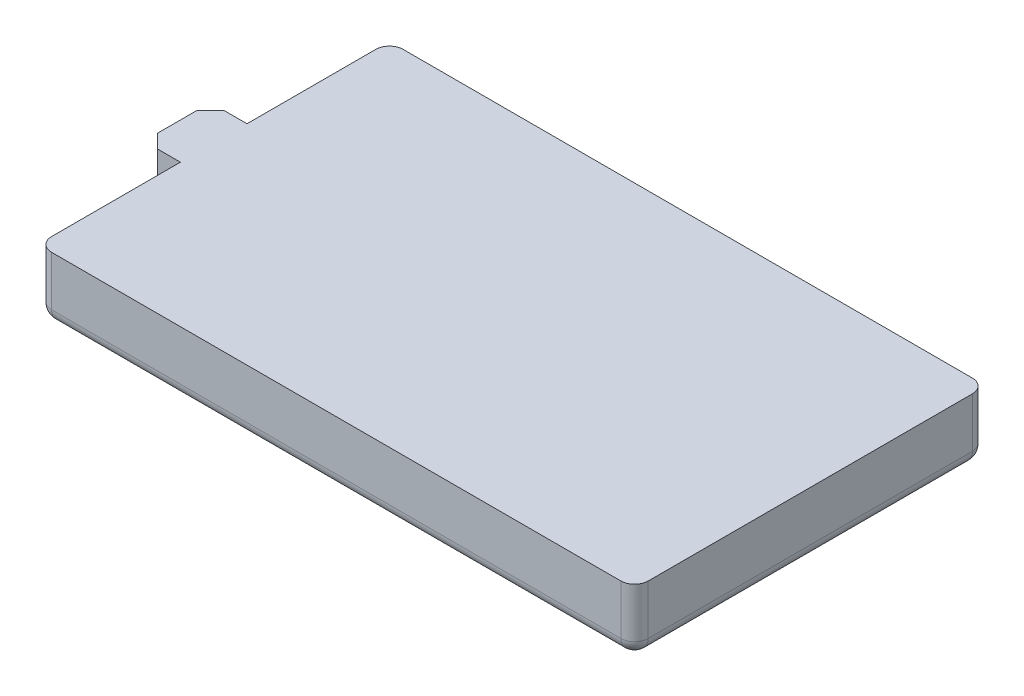
from build123d import *

# Parameters (mm, degrees)
BOSS_EXTRUDE1_DEPTH = 11.7856
FILLET1_R           = 2.54
CHAMFER1_SIZE       = 2.54


with BuildPart() as part:
    # Sketch1 → Boss-Extrude1 (new body)
    with BuildSketch(Plane(origin=(0, 0, 0), x_dir=(1, 0, 0), z_dir=(0, 1, 0))):
        Polygon((-55.35295, 32.6136), (55.35295, 32.6136), (55.35295, -32.6136), (-55.35295, -32.6136), (-55.35295, -6.17855), (-62.13475, -6.17855), (-62.13475, 0), (-62.13475, 6.17855), (-55.35295, 6.17855), align=None)
    extrude(amount=BOSS_EXTRUDE1_DEPTH)

    # Fillet1
    fillet1_edges = [part.edges().sort_by_distance(p)[0] for p in [
        (-55.35295, 0, -19.396075),
        (0, 0, -32.6136),
        (55.35295, 0, 0),
        (55.35295, 5.8928, 32.6136),
        (-55.35295, 5.8928, 32.6136),
        (-55.35295, 5.8928, -32.6136),
        (55.35295, 5.8928, -32.6136),
        (0, 0, 32.6136),
        (-55.35295, 0, 19.396075),
    ]]
    fillet(fillet1_edges, radius=FILLET1_R)

    # Chamfer1
    chamfer1_edges = [part.edges().sort_by_distance(p)[0] for p in [
        (-62.13475, 5.8928, 6.17855),
        (-62.13475, 5.8928, -6.17855),
    ]]
    chamfer(chamfer1_edges, length=CHAMFER1_SIZE)


solid = part.part
